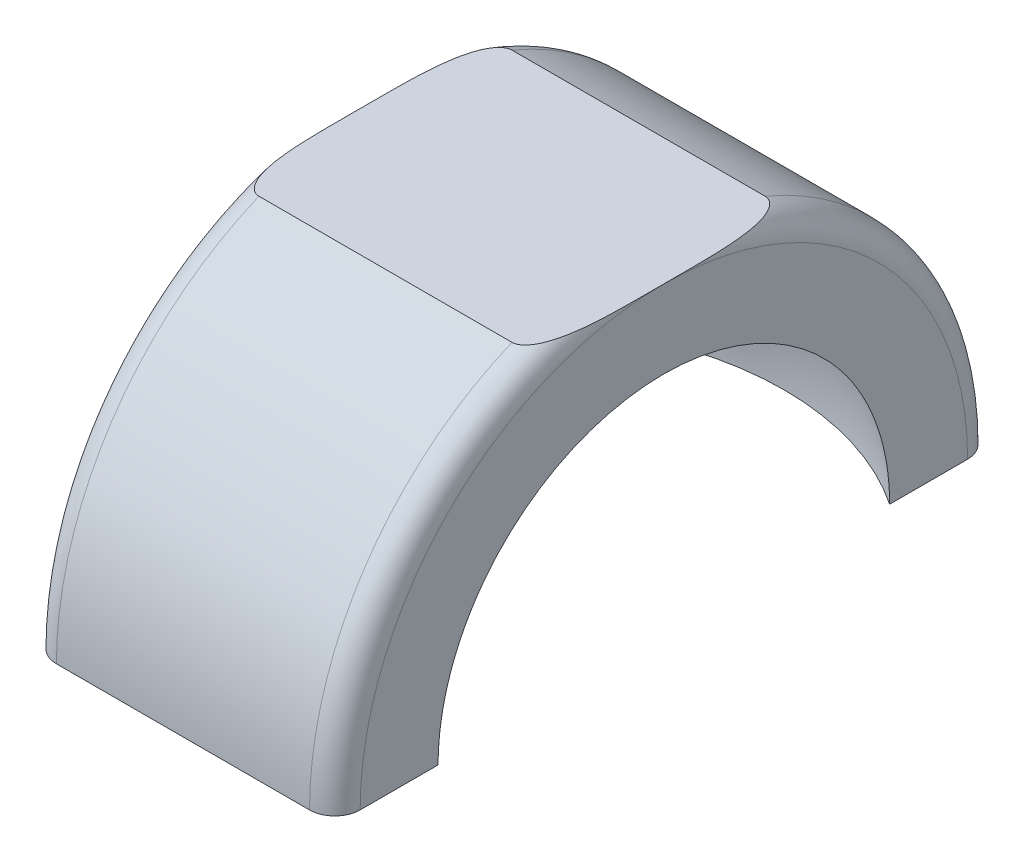
from build123d import *

# Parameters (mm, degrees)
BASE_R_VOLUTION_ANGLE   = 180
ESQUISSE2_W             = 44
ESQUISSE2_H             = 6
ENL_V_MAT_EXTRU_1_DEPTH = 44.908996859


with BuildPart() as part:
    # Esquisse1 → Base-Révolution (revolve, symmetric)
    with BuildSketch(Plane.XY) as base_r_volution_sk:
        with BuildLine():
            Line((-12, 17.839562775), (-12, 24))
            ThreePointArc((-12, 24), (-11.414213562, 25.414213562), (-10, 26))
            Line((-10, 26), (10, 26))
            ThreePointArc((10, 26), (11.414213562, 25.414213562), (12, 24))
            Line((12, 24), (12, 17.839562775))
            ThreePointArc((12, 17.839562775), (0, 21.5), (-12, 17.839562775))
        make_face()
    revolve(axis=Axis((-22, 0, 0), (1, 0, 0)), revolution_arc=BASE_R_VOLUTION_ANGLE / 2)
    revolve(base_r_volution_sk.sketch, axis=Axis((-22, 0, 0), (-1, 0, 0)), revolution_arc=BASE_R_VOLUTION_ANGLE / 2)

    # Esquisse2 → Enlèv. mat.-Extru.1 (cut, through all)
    with BuildSketch(Plane(origin=(12, 0, 0), x_dir=(0, 0, -1), z_dir=(1, 0, 0))):
        with Locations((0, 27)):
            Rectangle(ESQUISSE2_W, ESQUISSE2_H)
    extrude(amount=-ENL_V_MAT_EXTRU_1_DEPTH, mode=Mode.SUBTRACT)


solid = part.part
